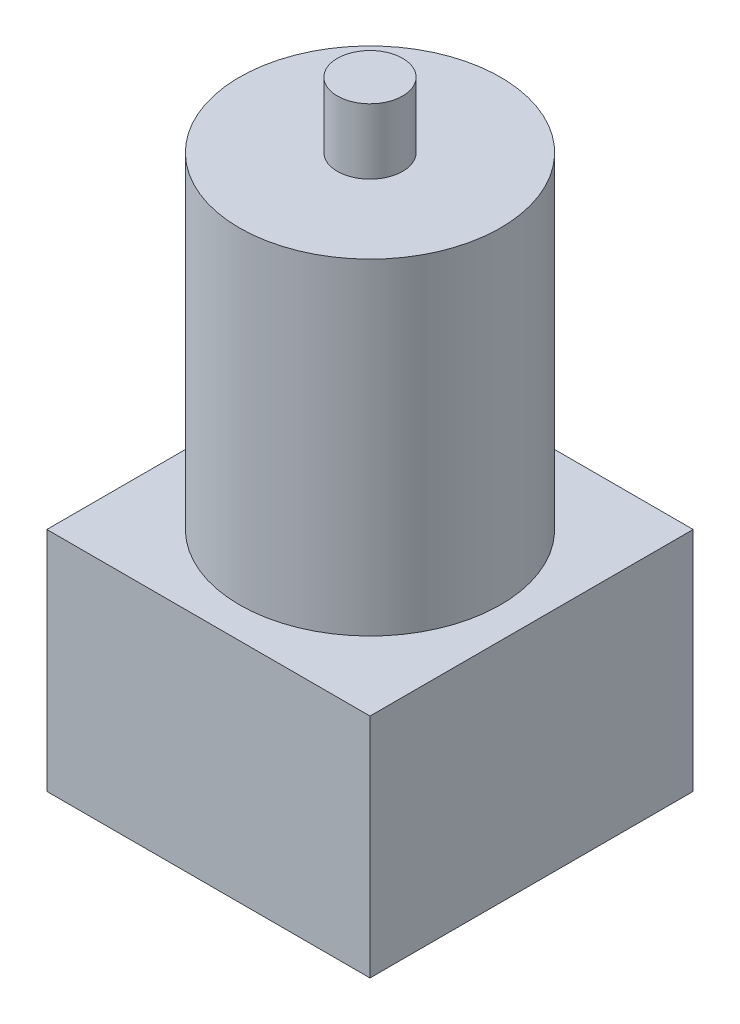
from build123d import *

# Parameters (mm, degrees)
SKETCH1_R           = 20
BOSS_EXTRUDE1_DEPTH = 50
SKETCH2_R           = 5
BOSS_EXTRUDE2_DEPTH = 10
SKETCH3_R           = 1.5
CUT_EXTRUDE1_DEPTH  = 16
SKETCH4_W           = 49.5
SKETCH4_H           = 49.5
BOSS_EXTRUDE3_DEPTH = 34.75


with BuildPart() as part:
    # Sketch1 → Boss-Extrude1 (new body)
    with BuildSketch(Plane(origin=(0, 0, 0), x_dir=(1, 0, 0), z_dir=(0, 1, 0))):
        with Locations(Location((0, 0, 0), (0, 0, 270))):
            Circle(SKETCH1_R)
    extrude(amount=BOSS_EXTRUDE1_DEPTH)

    # Sketch2 → Boss-Extrude2 (add)
    with BuildSketch(Plane(origin=(0, 50, 0), x_dir=(1, 0, 0), z_dir=(0, 1, 0))):
        with Locations(Location((0, 0, 0), (0, 0, 270))):
            Circle(SKETCH2_R)
    extrude(amount=BOSS_EXTRUDE2_DEPTH)

    # Sketch3 → Cut-Extrude1 (cut)
    with BuildSketch(Plane.XY):
        with Locations((0, 55.836490144)):
            Circle(SKETCH3_R)
    extrude(amount=-CUT_EXTRUDE1_DEPTH, mode=Mode.SUBTRACT)

    # Sketch4 → Boss-Extrude3 (add)
    with BuildSketch(Plane(origin=(0, 0, 0), x_dir=(-1, 0, 0), z_dir=(0, -1, 0))):
        Rectangle(SKETCH4_W, SKETCH4_H)
    extrude(amount=BOSS_EXTRUDE3_DEPTH)


solid = part.part
